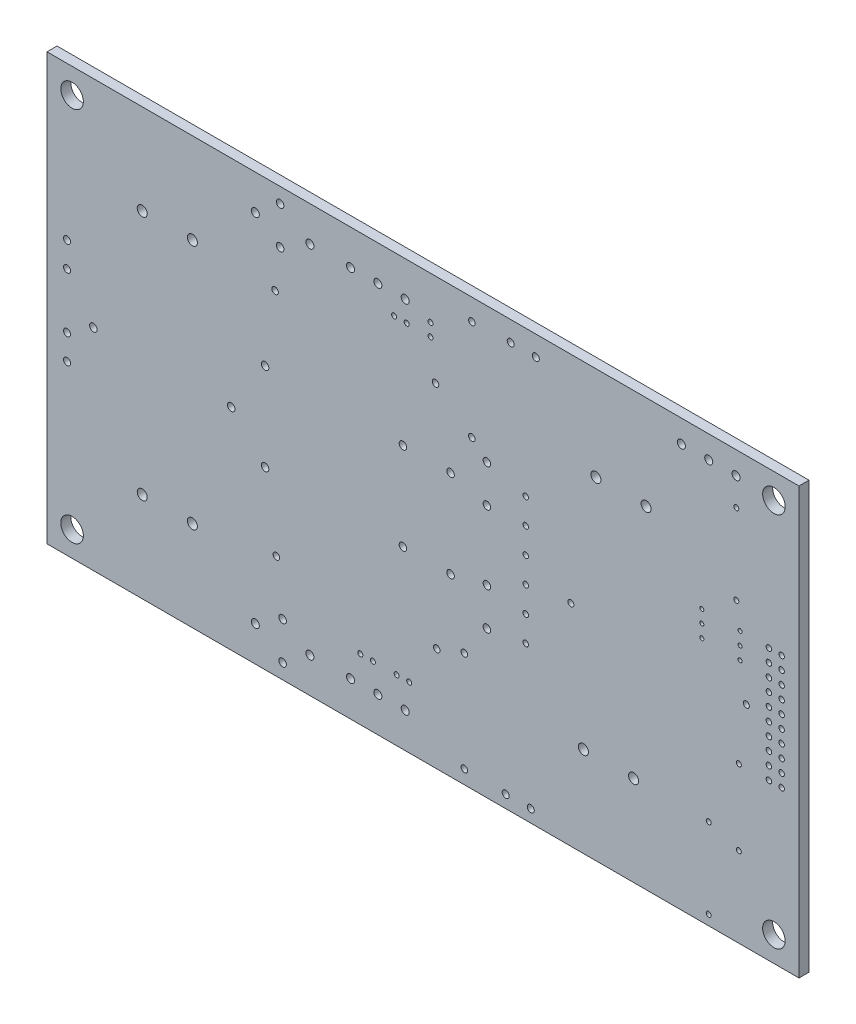
from build123d import *

# Parameters (mm, degrees)
SKETCH_1_W          = 150
SKETCH_1_H          = 85
SKETCH_1_R          = 2.25
EXTRUDE_1_DEPTH     = 2
SKETCH_2_R          = 0.55
SKETCH_2_R_2        = 0.5
SKETCH_2_R_3        = 0.8
CUT_EXTRUDE_1_DEPTH = 2
SKETCH_3_R          = 1
SKETCH_3_R_2        = 0.7
SKETCH_3_R_3        = 0.5
SKETCH_3_R_4        = 0.4
SKETCH_3_R_5        = 0.6
CUT_EXTRUDE_2_DEPTH = 10
SKETCH_4_R          = 0.75
SKETCH_4_R_2        = 0.65
CUT_EXTRUDE_3_DEPTH = 10
SKETCH_5_R          = 0.5
CUT_EXTRUDE_4_DEPTH = 10


with BuildPart() as part:
    # Эскиз1 → Вытянуть1 (new body)
    with BuildSketch(Plane.XY):
        Rectangle(SKETCH_1_W, SKETCH_1_H)
        with Locations((-70, -37.5)):
            Circle(SKETCH_1_R, mode=Mode.SUBTRACT)
        with Locations(Location((70, -37.5, 0), (0, 0, 180))):
            Circle(SKETCH_1_R, mode=Mode.SUBTRACT)
        with Locations((70, 37.5)):
            Circle(SKETCH_1_R, mode=Mode.SUBTRACT)
        with Locations(Location((-70, 37.5, 0), (0, 0, 180))):
            Circle(SKETCH_1_R, mode=Mode.SUBTRACT)
    extrude(amount=EXTRUDE_1_DEPTH)

    # Эскиз2 → Вырез-Вытянуть1 (cut)
    with BuildSketch(Plane.XY.offset(2)):
        with Locations((69, 11.5)):
            Circle(SKETCH_2_R)
        with Locations((71.54, 11.5)):
            Circle(SKETCH_2_R)
        with Locations((69, 8.96)):
            Circle(SKETCH_2_R)
        with Locations((71.54, 8.96)):
            Circle(SKETCH_2_R)
        with Locations((69, 6.42)):
            Circle(SKETCH_2_R)
        with Locations((71.54, 6.42)):
            Circle(SKETCH_2_R)
        with Locations((69, 3.88)):
            Circle(SKETCH_2_R)
        with Locations((71.54, 3.88)):
            Circle(SKETCH_2_R)
        with Locations((69, 1.34)):
            Circle(SKETCH_2_R)
        with Locations((71.54, 1.34)):
            Circle(SKETCH_2_R)
        with Locations((69, -1.2)):
            Circle(SKETCH_2_R)
        with Locations((71.54, -1.2)):
            Circle(SKETCH_2_R)
        with Locations((69, -3.74)):
            Circle(SKETCH_2_R)
        with Locations((71.54, -3.74)):
            Circle(SKETCH_2_R)
        with Locations((69, -6.28)):
            Circle(SKETCH_2_R)
        with Locations((71.54, -6.28)):
            Circle(SKETCH_2_R)
        with Locations((69, -8.82)):
            Circle(SKETCH_2_R)
        with Locations((71.54, -8.82)):
            Circle(SKETCH_2_R)
        with Locations((69, -11.36)):
            Circle(SKETCH_2_R)
        with Locations((71.54, -11.36)):
            Circle(SKETCH_2_R)
        with Locations((63, -26.5)):
            Circle(SKETCH_2_R_2)
        with Locations((63, -11.5)):
            Circle(SKETCH_2_R_2)
        with Locations((-14.45, 35.5)):
            Circle(SKETCH_2_R_3)
        with Locations((-9, 35.5)):
            Circle(SKETCH_2_R_3)
        with Locations((-3.55, 35.5)):
            Circle(SKETCH_2_R_3)
        with Locations((-33.45, 35.5)):
            Circle(SKETCH_2_R_3)
        with Locations((51.55, 38)):
            Circle(SKETCH_2_R_3)
        with Locations((-22.55, 35.5)):
            Circle(SKETCH_2_R_3)
        with Locations((-33.45, -35.5)):
            Circle(SKETCH_2_R_3)
        with Locations((57, 38)):
            Circle(SKETCH_2_R_3)
        with Locations((-22.55, -35.5)):
            Circle(SKETCH_2_R_3)
        with Locations((-14.45, -35.5)):
            Circle(SKETCH_2_R_3)
        with Locations((-9, -35.5)):
            Circle(SKETCH_2_R_3)
        with Locations((-3.55, -35.5)):
            Circle(SKETCH_2_R_3)
        with Locations((62.45, 38)):
            Circle(SKETCH_2_R_3)
        with Locations(Location((20.5, 13.45, 0), (0, 0, 180))):
            Circle(SKETCH_2_R)
        with Locations(Location((20.5, 8.37, 0), (0, 0, 180))):
            Circle(SKETCH_2_R)
        with Locations(Location((20.5, -1.79, 0), (0, 0, 180))):
            Circle(SKETCH_2_R)
        with Locations(Location((20.5, 3.29, 0), (0, 0, 180))):
            Circle(SKETCH_2_R)
        with Locations(Location((20.5, -6.87, 0), (0, 0, 180))):
            Circle(SKETCH_2_R)
        with Locations((20.5, -11.95)):
            Circle(SKETCH_2_R)
    extrude(amount=-CUT_EXTRUDE_1_DEPTH, mode=Mode.SUBTRACT)

    # Эскиз3 → Вырез-Вытянуть2 (cut)
    with BuildSketch(Plane.XY.offset(2)):
        with Locations((-56, 24.5)):
            Circle(SKETCH_3_R)
        with Locations((-46, 24.5)):
            Circle(SKETCH_3_R)
        with Locations((-56, -24.5)):
            Circle(SKETCH_3_R)
        with Locations((-46, -24.5)):
            Circle(SKETCH_3_R)
        with Locations((16.5, -40)):
            Circle(SKETCH_3_R_2)
        with Locations((21.5, -40)):
            Circle(SKETCH_3_R_2)
        with Locations((-71, 7)):
            Circle(SKETCH_3_R_2)
        with Locations((-71, 12)):
            Circle(SKETCH_3_R_2)
        with Locations((-71, -9)):
            Circle(SKETCH_3_R_2)
        with Locations((-71, -4)):
            Circle(SKETCH_3_R_2)
        with Locations((57, -40.5)):
            Circle(SKETCH_3_R_3)
        with Locations((57, -24.5)):
            Circle(SKETCH_3_R_3)
        with Locations((34.5, 23.75)):
            Circle(SKETCH_3_R)
        with Locations((44.5, 23.75)):
            Circle(SKETCH_3_R)
        with Locations((32, -24.5)):
            Circle(SKETCH_3_R)
        with Locations((42, -24.5)):
            Circle(SKETCH_3_R)
        with Locations((17.5, 38.5)):
            Circle(SKETCH_3_R_2)
        with Locations((62.5, 16.5)):
            Circle(SKETCH_3_R_3)
        with Locations((62.5, 32.5)):
            Circle(SKETCH_3_R_3)
        with Locations((63.24, 11.58)):
            Circle(SKETCH_3_R_4)
        with Locations((63.24, 6.5)):
            Circle(SKETCH_3_R_4)
        with Locations((55.62, 9.04)):
            Circle(SKETCH_3_R_4)
        with Locations((63.24, 9.04)):
            Circle(SKETCH_3_R_4)
        with Locations((55.62, 6.5)):
            Circle(SKETCH_3_R_4)
        with Locations((55.62, 11.58)):
            Circle(SKETCH_3_R_4)
        with Locations((22.5, 38.5)):
            Circle(SKETCH_3_R_2)
        with Locations((64.5, -0.5)):
            Circle(SKETCH_3_R_5)
        with Locations((29.5, -0.5)):
            Circle(SKETCH_3_R_5)
    extrude(amount=-CUT_EXTRUDE_2_DEPTH, mode=Mode.SUBTRACT)

    # Эскиз4 → Вырез-Вытянуть3 (cut)
    with BuildSketch(Plane.XY.offset(2)):
        with Locations((12.75, -5.75)):
            Circle(SKETCH_4_R)
        with Locations((-29.5, 24)):
            Circle(SKETCH_4_R_2)
        with Locations((12.75, -13.25)):
            Circle(SKETCH_4_R)
        with Locations((5.5, 10)):
            Circle(SKETCH_4_R)
        with Locations((2.5, 24)):
            Circle(SKETCH_4_R_2)
        with Locations((12.75, 15.5)):
            Circle(SKETCH_4_R)
        with Locations((5.5, -7.5)):
            Circle(SKETCH_4_R)
        with Locations((-65.75, -0.5)):
            Circle(SKETCH_4_R)
        with Locations((12.75, 8)):
            Circle(SKETCH_4_R)
        with Locations((8.25, -39.75)):
            Circle(SKETCH_4_R_2)
        with Locations((8.25, -19.75)):
            Circle(SKETCH_4_R_2)
        with Locations((-38.25, -0.5)):
            Circle(SKETCH_4_R)
        with Locations((9.75, 18.25)):
            Circle(SKETCH_4_R_2)
        with Locations((9.75, 38.25)):
            Circle(SKETCH_4_R_2)
        with Locations((-28.5, 39.5)):
            Circle(SKETCH_4_R)
        with Locations((-31.5, 10)):
            Circle(SKETCH_4_R)
        with Locations((-4, 10)):
            Circle(SKETCH_4_R)
        with Locations((-28.5, 32)):
            Circle(SKETCH_4_R)
        with Locations((-28, -32)):
            Circle(SKETCH_4_R)
        with Locations((-28, -39.5)):
            Circle(SKETCH_4_R)
        with Locations((-31.5, -7.5)):
            Circle(SKETCH_4_R)
        with Locations((-4, -7.5)):
            Circle(SKETCH_4_R)
        with Locations((-29.25, -21.75)):
            Circle(SKETCH_4_R_2)
        with Locations((2.75, -21.75)):
            Circle(SKETCH_4_R_2)
    extrude(amount=-CUT_EXTRUDE_3_DEPTH, mode=Mode.SUBTRACT)

    # Эскиз5 → Вырез-Вытянуть4 (cut)
    with BuildSketch(Plane.XY.offset(2)):
        with Locations((1.5, 34)):
            Circle(SKETCH_5_R)
        with Locations((1.5, 31.5)):
            Circle(SKETCH_5_R)
        with Locations((-5.75, 31.5)):
            Circle(SKETCH_5_R)
        with Locations((-3.25, 31.5)):
            Circle(SKETCH_5_R)
        with Locations((-5.25, -30.25)):
            Circle(SKETCH_5_R)
        with Locations((-2.75, -30.25)):
            Circle(SKETCH_5_R)
        with Locations((-10, -30.25)):
            Circle(SKETCH_5_R)
        with Locations((-12.5, -30.25)):
            Circle(SKETCH_5_R)
    extrude(amount=-CUT_EXTRUDE_4_DEPTH, mode=Mode.SUBTRACT)


solid = part.part
